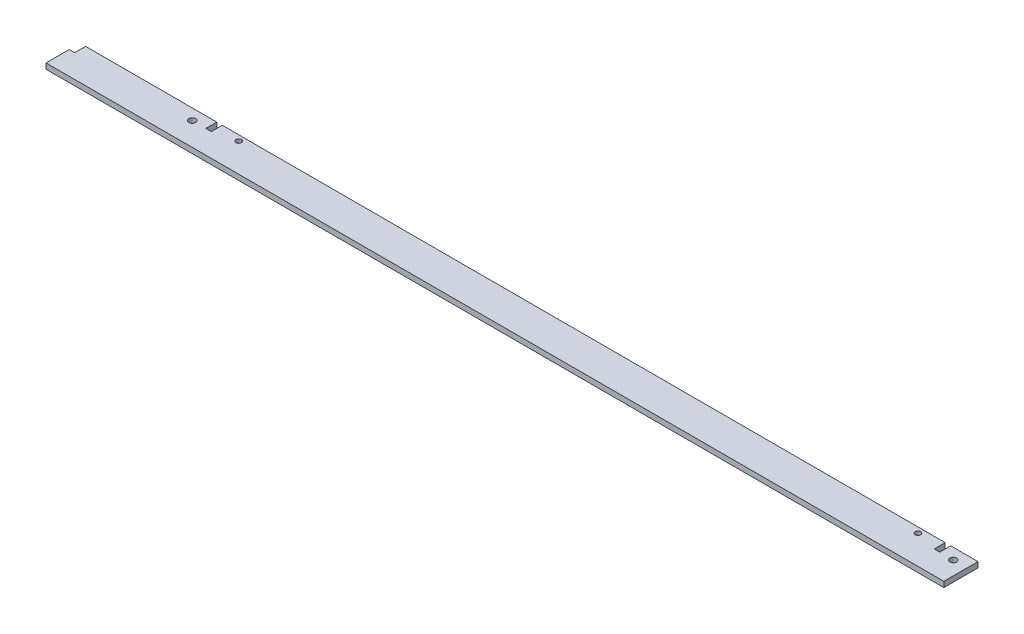
from build123d import *

# Parameters (mm, degrees)
SKETCH2_R           = 2.5
SKETCH2_R_2         = 2
BOSS_EXTRUDE2_DEPTH = 4
SKETCH3_W           = 4
SKETCH3_H           = 8
CUT_EXTRUDE1_DEPTH  = 4


with BuildPart() as part:
    # Sketch2 → Boss-Extrude2 (new body)
    with BuildSketch(Plane(origin=(0, 0, 0), x_dir=(1, 0, 0), z_dir=(0, 1, 0))):
        Polygon((-362.438698088, -81.105028172), (-262.438698088, -81.105028172), (-262.438698088, -89.105028172), (-258.438698088, -89.105028172), (-258.438698088, -81.105028172), (270.561301912, -81.105028172), (270.561301912, -89.105028172), (274.561301912, -89.105028172), (274.561301912, -81.105028172), (294.561301912, -81.105028172), (294.561301912, -106.105028172), (-362.438698088, -106.105028172), align=None)
        with Locations(Location((284.561301912, -89.105028172, 0), (0, 0, 270))):
            Circle(SKETCH2_R, mode=Mode.SUBTRACT)
        with Locations(Location((-272.438698088, -89.105028172, 0), (0, 0, 270))):
            Circle(SKETCH2_R, mode=Mode.SUBTRACT)
        with Locations(Location((254.561301912, -85.105028172, 0), (0, 0, 270))):
            Circle(SKETCH2_R_2, mode=Mode.SUBTRACT)
        with Locations(Location((-242.438698088, -85.105028172, 0), (0, 0, 270))):
            Circle(SKETCH2_R_2, mode=Mode.SUBTRACT)
    extrude(amount=BOSS_EXTRUDE2_DEPTH)

    # Sketch3 → Cut-Extrude1 (cut)
    with BuildSketch(Plane(origin=(0, 4, 0), x_dir=(1, 0, 0), z_dir=(0, 1, 0))):
        with Locations((-360.438698088, -85.105028172)):
            Rectangle(SKETCH3_W, SKETCH3_H)
    extrude(amount=-CUT_EXTRUDE1_DEPTH, mode=Mode.SUBTRACT)


solid = part.part
